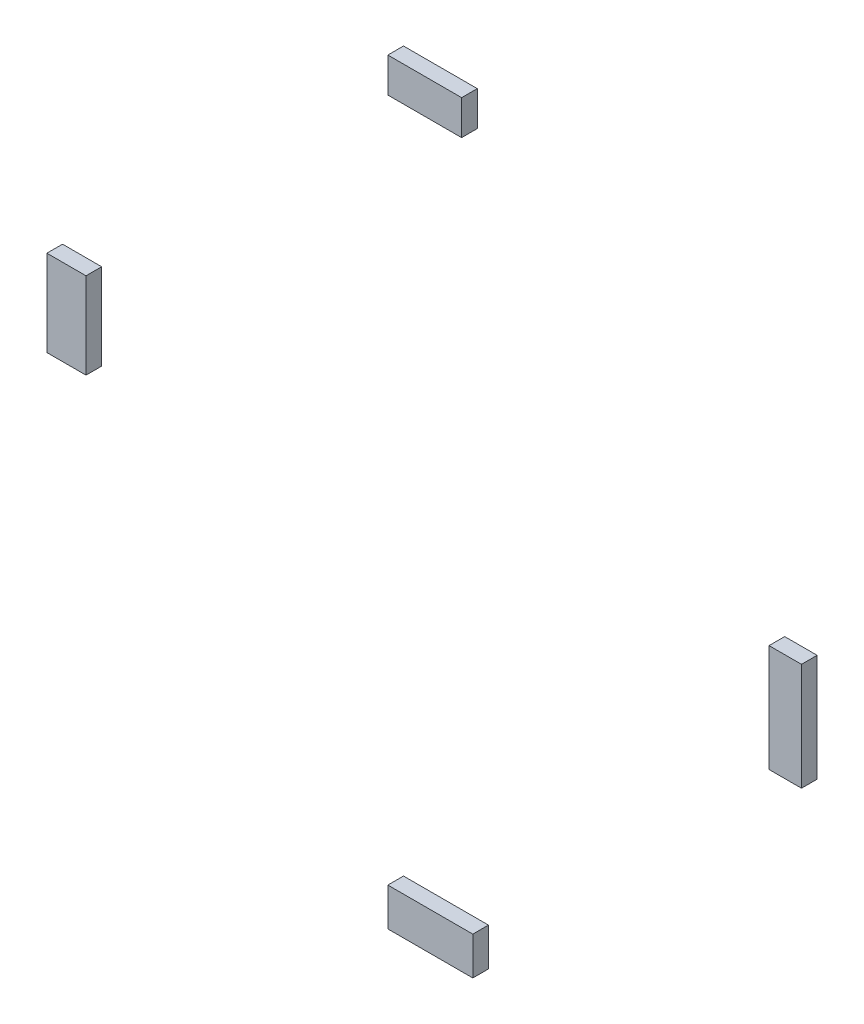
from build123d import *

# Parameters (mm, degrees)
ESQUISSE2_W          = 14.14483726
ESQUISSE2_H          = 6.643787198
BOSS_EXTRU_1_DEPTH   = 3
ESQUISSE2_W_2        = 7.501050062
ESQUISSE2_H_2        = 16.502310136
BOSS_EXTRU_1_2_DEPTH = 3
ESQUISSE2_W_3        = 6.215155766
ESQUISSE2_H_3        = 20.574308742
BOSS_EXTRU_1_3_DEPTH = 3
ESQUISSE2_W_4        = 16.28799442
ESQUISSE2_H_4        = 7.286734346
BOSS_EXTRU_1_4_DEPTH = 3


with BuildPart() as part:
    # Esquisse2 → Boss.-Extru.1 (new body)
    with BuildSketch(Plane.XY):
        with Locations((-0.101092489, 69.338134115)):
            Rectangle(ESQUISSE2_W, ESQUISSE2_H)
    extrude(amount=BOSS_EXTRU_1_DEPTH)


with BuildPart() as body_2:
    # Esquisse2 → Boss.-Extru.1 2 (new body)
    with BuildSketch(Plane.XY):
        with Locations((-68.789279487, -1.171736469)):
            Rectangle(ESQUISSE2_W_2, ESQUISSE2_H_2)
    extrude(amount=BOSS_EXTRU_1_2_DEPTH)


with BuildPart() as body_3:
    # Esquisse2 → Boss.-Extru.1 3 (new body)
    with BuildSketch(Plane.XY):
        with Locations((69.01572594, 0.864262834)):
            Rectangle(ESQUISSE2_W_3, ESQUISSE2_H_3)
    extrude(amount=BOSS_EXTRU_1_3_DEPTH)


with BuildPart() as body_4:
    # Esquisse2 → Boss.-Extru.1 4 (new body)
    with BuildSketch(Plane.XY):
        with Locations((0.970486091, -68.788344886)):
            Rectangle(ESQUISSE2_W_4, ESQUISSE2_H_4)
    extrude(amount=BOSS_EXTRU_1_4_DEPTH)


solid = Compound([part.part, body_2.part, body_3.part, body_4.part])
